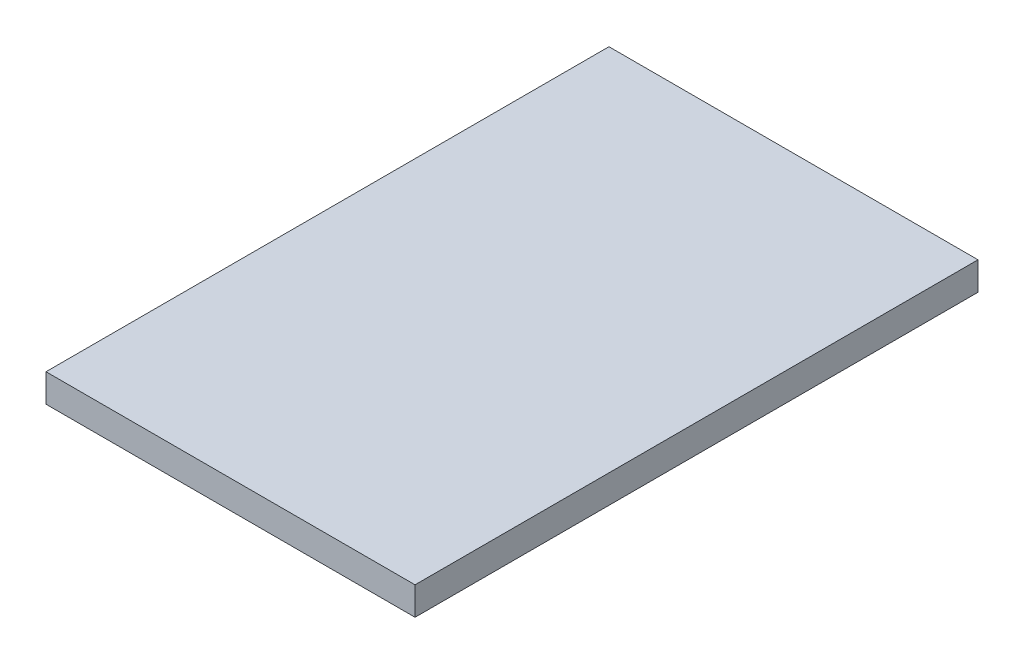
from build123d import *

# Parameters (mm, degrees)
CROQUIS1_W              = 236
CROQUIS1_H              = 360
SALIENTE_EXTRUIR1_DEPTH = 18


with BuildPart() as part:
    # Croquis1 → Saliente-Extruir1 (new body)
    with BuildSketch(Plane(origin=(0, 0, 0), x_dir=(1, 0, 0), z_dir=(0, 1, 0))):
        Rectangle(CROQUIS1_W, CROQUIS1_H)
    extrude(amount=SALIENTE_EXTRUIR1_DEPTH)


solid = part.part
